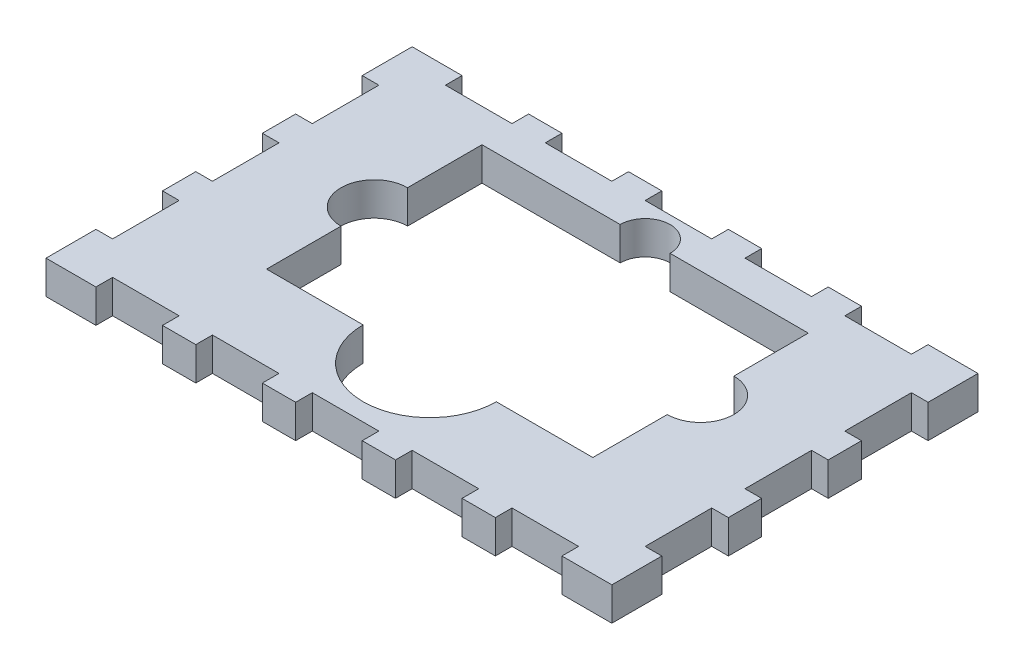
from build123d import *

# Parameters (mm, degrees)
SKETCH7_W           = 203.2
SKETCH7_H           = 127
SKETCH7_W_2         = 124.5
SKETCH7_H_2         = 82.199999938
BOSS_EXTRUDE4_DEPTH = 12.7
SKETCH8_W           = 12.7
SKETCH8_H           = 6.35
SKETCH8_W_2         = 6.35
SKETCH8_H_2         = 12.7
BOSS_EXTRUDE5_DEPTH = 12.7
SKETCH10_R          = 9.525
SKETCH10_R_2        = 12.7
SKETCH10_R_3        = 25.4
CUT_EXTRUDE1_DEPTH  = 130.203386179


with BuildPart() as part:
    # Sketch7 → Boss-Extrude4 (new body)
    with BuildSketch(Plane(origin=(0, 0, 0), x_dir=(1, 0, 0), z_dir=(0, 1, 0))):
        Rectangle(SKETCH7_W, SKETCH7_H)
        with Locations((0, 9.700000031)):
            Rectangle(SKETCH7_W_2, SKETCH7_H_2, mode=Mode.SUBTRACT)
    extrude(amount=BOSS_EXTRUDE4_DEPTH)

    # Sketch8 → Boss-Extrude5 (add)
    with BuildSketch(Plane(origin=(0, 0, 0), x_dir=(1, 0, 0), z_dir=(0, 1, 0))):
        Polygon((-101.6, 69.85), (-88.9, 69.85), (-88.9, 63.5), (-101.6, 50.8), (-107.95, 50.8), (-107.95, 63.5), (-107.95, 69.85), align=None)
        with Locations((-57.15, 66.675)):
            Rectangle(SKETCH8_W, SKETCH8_H)
        with Locations((-19.05, 66.675)):
            Rectangle(SKETCH8_W, SKETCH8_H)
        with Locations((19.05, 66.675)):
            Rectangle(SKETCH8_W, SKETCH8_H)
        with Locations((57.15, 66.675)):
            Rectangle(SKETCH8_W, SKETCH8_H)
        with Locations((-104.775, 19.05)):
            Rectangle(SKETCH8_W_2, SKETCH8_H_2)
        with Locations((-104.775, -19.05)):
            Rectangle(SKETCH8_W_2, SKETCH8_H_2)
        Polygon((-101.6, -50.8), (-88.9, -63.5), (-88.9, -69.85), (-101.6, -69.85), (-107.95, -69.85), (-107.95, -63.5), (-107.95, -50.8), align=None)
        Polygon((101.6, 50.8), (88.9, 63.5), (88.9, 69.85), (101.6, 69.85), (107.95, 69.85), (107.95, 63.5), (107.95, 50.8), align=None)
        Polygon((101.6, -69.85), (88.9, -69.85), (88.9, -63.5), (101.6, -50.8), (107.95, -50.8), (107.95, -63.5), (107.95, -69.85), align=None)
        with Locations((104.775, -19.05)):
            Rectangle(SKETCH8_W_2, SKETCH8_H_2)
        with Locations((104.775, 19.05)):
            Rectangle(SKETCH8_W_2, SKETCH8_H_2)
        with Locations((57.15, -66.675)):
            Rectangle(SKETCH8_W, SKETCH8_H)
        with Locations((19.05, -66.675)):
            Rectangle(SKETCH8_W, SKETCH8_H)
        with Locations((-19.05, -66.675)):
            Rectangle(SKETCH8_W, SKETCH8_H)
        with Locations((-57.15, -66.675)):
            Rectangle(SKETCH8_W, SKETCH8_H)
    extrude(amount=BOSS_EXTRUDE5_DEPTH)

    # Sketch10 → Cut-Extrude1 (cut, through all)
    with BuildSketch(Plane(origin=(0, 12.7, 0), x_dir=(1, 0, 0), z_dir=(0, 1, 0))):
        with Locations((0, 50.8)):
            Circle(SKETCH10_R)
        with Locations((-62.25, 9.700000031)):
            Circle(SKETCH10_R_2)
        with Locations((0, -31.399999938)):
            Circle(SKETCH10_R_3)
        with Locations((62.25, 9.700000031)):
            Circle(SKETCH10_R_2)
    extrude(amount=-CUT_EXTRUDE1_DEPTH, mode=Mode.SUBTRACT)


solid = part.part
